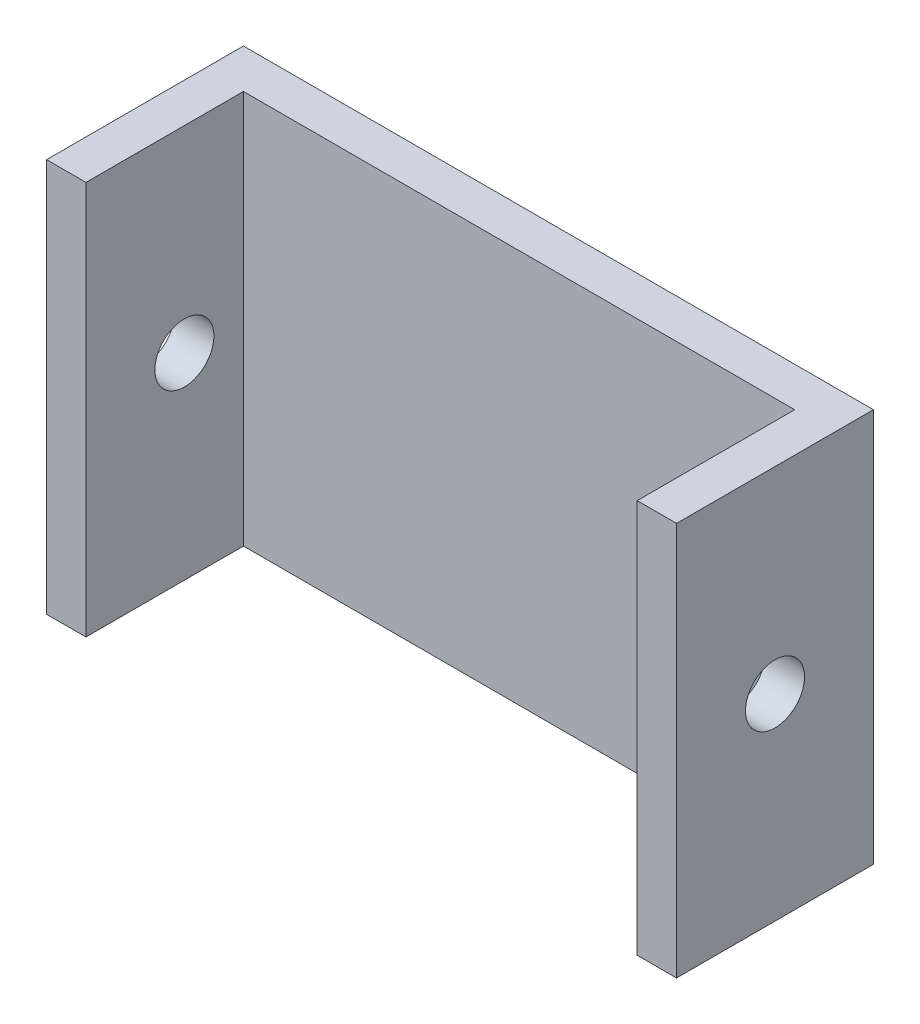
from build123d import *

# Parameters (mm, degrees)
ESQUISSE1_W                  = 28
ESQUISSE1_H                  = 20
BOSS_EXTRU_1_DEPTH           = 2
ESQUISSE2_W                  = 2
ESQUISSE2_H                  = 20
BOSS_EXTRU_2_DEPTH           = 10
ENL_V_MAT_EXTRU_1_DEPTH      = 22.354156504
ENL_V_MAT_EXTRU_1_DEPTH_BACK = 22.354156504
ESQUISSE3_R                  = 1.5
ESQUISSE4_W                  = 1.099038462
ESQUISSE4_H                  = 0.529166666
ENL_V_MAT_EXTRU_2_DEPTH      = 1


with BuildPart() as part:
    # Esquisse1 → Boss.-Extru.1 (new body)
    with BuildSketch(Plane.XY):
        Rectangle(ESQUISSE1_W, ESQUISSE1_H)
    extrude(amount=BOSS_EXTRU_1_DEPTH)

    # Esquisse2 → Boss.-Extru.2 (add)
    with BuildSketch(Plane.XY):
        with Locations((-15, 0)):
            Rectangle(ESQUISSE2_W, ESQUISSE2_H)
        with Locations((15, 0)):
            Rectangle(ESQUISSE2_W, ESQUISSE2_H)
    extrude(amount=BOSS_EXTRU_2_DEPTH)

    # Esquisse3 → Enlèv. mat.-Extru.1 (cut, two sides: drawn at the far end of the back side and taken through both)
    with BuildSketch(Plane(origin=(0, 0, 0), x_dir=(0, 0, -1), z_dir=(1, 0, 0)).offset(-ENL_V_MAT_EXTRU_1_DEPTH_BACK)):
        with Locations((-5, 0)):
            Circle(ESQUISSE3_R)
    extrude(amount=ENL_V_MAT_EXTRU_1_DEPTH + ENL_V_MAT_EXTRU_1_DEPTH_BACK, mode=Mode.SUBTRACT)

    # Esquisse4 → Enlèv. mat.-Extru.2 (cut)
    # profile 1 of 10: a face of its own
    with BuildSketch(Plane(origin=(0, 0, 0), x_dir=(-1, 0, 0), z_dir=(0, 0, -1))):
        Polygon((-14.382426883, 2.175), (-13.790930489, 2.175), (-13.06650641, -0.039613381), (-12.336994191, 2.175), (-11.751221955, 2.175), (-11.214423077, -1), (-11.791291066, -1), (-12.130288462, 1.005363582), (-12.79047476, -1), (-13.346354167, -1), (-14.002724359, 1.005363582), (-14.341085737, -1), (-14.918589744, -1), align=None)
    # profile 2 of 10: a face of its own
    with BuildSketch(Plane(origin=(0, 0, 0), x_dir=(-1, 0, 0), z_dir=(0, 0, -1))):
        with BuildLine():
            Line((-7.958012821, -0.547791466), (-7.419305889, -1.244230769))
            Line((-7.419305889, -1.244230769), (-8.128465545, -1.244230769))
            Line((-8.128465545, -1.244230769), (-8.407677284, -0.883608774))
            add(Edge.make_bspline(
                [(-8.407677284, -0.883608774), (-8.436923867, -0.899533813), (-8.495279076, -0.931308772), (-8.586787742, -0.970931892), (-8.679990398, -1.005692185), (-8.776237577, -1.032930336), (-8.874605223, -1.054370068), (-8.975603022, -1.070739654), (-9.079158703, -1.079370973), (-9.149047866, -1.080727101), (-9.184254808, -1.081410256)],
                knots=[0, 0, 0, 0, 0.985706899, 1.966764212, 2.949968678, 3.929638882, 4.925906056, 5.930211904, 6.957336097, 8, 8, 8, 8], degree=3))
            add(Edge.make_bspline(
                [(-9.184254808, -1.081410256), (-9.242859715, -1.080094869), (-9.357805858, -1.077514902), (-9.526147519, -1.052742163), (-9.687300674, -1.01534206), (-9.840667131, -0.960698595), (-9.986763562, -0.89125893), (-10.124422049, -0.805205067), (-10.255243795, -0.704922884), (-10.37602809, -0.589428191), (-10.486543835, -0.464268204), (-10.583108174, -0.33129517), (-10.665194204, -0.192583753), (-10.732137682, -0.047916361), (-10.784193041, 0.102956411), (-10.820646997, 0.259622481), (-10.843758221, 0.422298361), (-10.846622918, 0.532724268), (-10.848076923, 0.588772035)],
                knots=[0, 0, 0, 0, 1.070144486, 2.098953612, 3.10240755, 4.088674545, 5.067611437, 6.052256776, 7.0494179, 8.074208254, 9.100739571, 10.09639475, 11.072322686, 12.041159829, 13.004031207, 13.983083054, 14.976293755, 16, 16, 16, 16], degree=3))
            add(Edge.make_bspline(
                [(-10.848076923, 0.588772035), (-10.847592214, 0.626327381), (-10.846628933, 0.700962536), (-10.835043388, 0.811570612), (-10.818327857, 0.92000964), (-10.793785207, 1.025696745), (-10.763522437, 1.12940729), (-10.725017212, 1.230316673), (-10.680393258, 1.32938311), (-10.629199705, 1.425783598), (-10.571050731, 1.518092805), (-10.509258594, 1.607044208), (-10.44052463, 1.68978176), (-10.367281634, 1.768168735), (-10.289289031, 1.842153791), (-10.205318552, 1.910211938), (-10.116965871, 1.974032133), (-10.023594389, 2.032276403), (-9.926825064, 2.084923569), (-9.827548543, 2.130677527), (-9.726520447, 2.169819583), (-9.623703082, 2.201705354), (-9.5187837, 2.225600525), (-9.412685506, 2.2437941), (-9.304446436, 2.253914479), (-9.231763487, 2.255572932), (-9.195067107, 2.256410256)],
                knots=[0, 0, 0, 0, 1.035855852, 2.058595393, 3.065553363, 4.06176554, 5.050183643, 6.044349766, 7.039272903, 8.046842428, 9.053256483, 10.04817962, 11.033146707, 12.018200652, 13.007259073, 13.996749908, 14.99846043, 16.012935138, 17.03119782, 18.036301871, 19.027088812, 20.018894167, 21.003704893, 21.994284571, 22.987348552, 24, 24, 24, 24], degree=3))
            add(Edge.make_bspline(
                [(-9.195067107, 2.256410256), (-9.139649678, 2.255001093), (-9.03044954, 2.252224334), (-8.869816845, 2.228480547), (-8.714911908, 2.190657267), (-8.566373477, 2.136010037), (-8.423293684, 2.067107178), (-8.287098509, 1.981850891), (-8.156346756, 1.881999288), (-8.033863117, 1.767504419), (-7.920670205, 1.643249914), (-7.821992695, 1.50993868), (-7.738456246, 1.370116061), (-7.668790529, 1.223726313), (-7.616305103, 1.069913898), (-7.578836807, 0.909700032), (-7.555120466, 0.742971999), (-7.552362935, 0.629345392), (-7.550961538, 0.571599559)],
                knots=[0, 0, 0, 0, 1.015551519, 2.00114601, 2.970254478, 3.93428303, 4.897362978, 5.876714212, 6.874912676, 7.909046156, 8.946527051, 9.952474942, 10.9443724, 11.928494229, 12.919233427, 13.917651329, 14.941735923, 16, 16, 16, 16], degree=3))
            add(Edge.make_bspline(
                [(-7.550961538, 0.571599559), (-7.552126601, 0.518324576), (-7.55441805, 0.413543185), (-7.574269513, 0.259073676), (-7.605603555, 0.11018576), (-7.650606884, -0.033226373), (-7.707638456, -0.171006407), (-7.778699966, -0.302744164), (-7.860642853, -0.43000364), (-7.925394355, -0.508333117), (-7.958012821, -0.547791466)],
                knots=[0, 0, 0, 0, 1.049646143, 2.064447078, 3.064298101, 4.044929938, 5.022708814, 5.998521441, 6.991758374, 8, 8, 8, 8], degree=3))
        make_face()
        with BuildLine():
            add(Edge.make_bspline(
                [(-8.331991186, -0.063146034), (-8.315027893, -0.038825922), (-8.281492128, 0.009253985), (-8.239058558, 0.085515257), (-8.202607642, 0.163262448), (-8.172464162, 0.242903528), (-8.149534051, 0.324894907), (-8.133235845, 0.408701319), (-8.12244288, 0.494361144), (-8.121372654, 0.552062342), (-8.120833333, 0.581139824)],
                knots=[0, 0, 0, 0, 1.031533623, 2.039301536, 3.033003023, 4.018477747, 4.999688364, 5.992485227, 6.988348989, 8, 8, 8, 8], degree=3))
            add(Edge.make_bspline(
                [(-8.120833333, 0.581139824), (-8.121837097, 0.61892283), (-8.123812852, 0.693292914), (-8.138652355, 0.802618034), (-8.163512375, 0.907390986), (-8.198175942, 1.007868214), (-8.241829216, 1.104307641), (-8.296666952, 1.195906242), (-8.361094089, 1.283139766), (-8.434488695, 1.365168117), (-8.514396154, 1.440242217), (-8.599379677, 1.506360438), (-8.688856307, 1.562140444), (-8.782878386, 1.607179158), (-8.880426001, 1.643454645), (-8.982545987, 1.667802938), (-9.088348253, 1.68376733), (-9.160450839, 1.685606706), (-9.19697516, 1.686538462)],
                knots=[0, 0, 0, 0, 1.056263418, 2.079093448, 3.078410197, 4.062632158, 5.04680056, 6.032966551, 7.041959893, 8.074807684, 9.106532056, 10.103754224, 11.080880922, 12.048629763, 13.014470275, 13.984975, 14.979267944, 16, 16, 16, 16], degree=3))
            add(Edge.make_bspline(
                [(-9.19697516, 1.686538462), (-9.234551191, 1.685555352), (-9.308508861, 1.683620382), (-9.4170851, 1.668494694), (-9.521232645, 1.644769489), (-9.620404053, 1.609934883), (-9.714899597, 1.566042518), (-9.804714942, 1.512185734), (-9.889399968, 1.448062961), (-9.969156019, 1.375552409), (-10.0412184, 1.295091877), (-10.104853743, 1.208811209), (-10.158114874, 1.116918458), (-10.202719121, 1.020250439), (-10.2362968, 0.917724644), (-10.260213025, 0.810142959), (-10.275327225, 0.697320349), (-10.277232385, 0.620409309), (-10.278205128, 0.581139824)],
                knots=[0, 0, 0, 0, 1.042613217, 2.052085894, 3.036973397, 4.002832266, 4.963730975, 5.924467509, 6.903642813, 7.907474205, 8.911719447, 9.896835452, 10.877830278, 11.85475743, 12.846581833, 13.865885605, 14.910357018, 16, 16, 16, 16], degree=3))
            add(Edge.make_bspline(
                [(-10.278205128, 0.581139824), (-10.276915703, 0.537620201), (-10.274388642, 0.452328951), (-10.256600021, 0.327911765), (-10.226186676, 0.210399284), (-10.182197655, 0.100425933), (-10.127839055, -0.003556676), (-10.05935651, -0.099333903), (-9.979723898, -0.188799484), (-9.918253289, -0.240876398), (-9.887054287, -0.267307692)],
                knots=[0, 0, 0, 0, 1.078047314, 2.112794111, 3.106520711, 4.077995885, 5.041371964, 6.006121678, 6.988020189, 8, 8, 8, 8], degree=3))
            add(Edge.make_bspline(
                [(-9.887054287, -0.267307692), (-9.861527566, -0.286873566), (-9.810905924, -0.325674345), (-9.729814505, -0.374788307), (-9.646700569, -0.417453824), (-9.560778229, -0.451564441), (-9.472344308, -0.478692482), (-9.381417611, -0.497484182), (-9.287820526, -0.509445903), (-9.224572614, -0.510834712), (-9.192523037, -0.511538462)],
                knots=[0, 0, 0, 0, 1.027457745, 2.037535419, 3.025615023, 4.011018129, 4.9886297, 5.978868484, 6.975833209, 8, 8, 8, 8], degree=3))
            add(Edge.make_bspline(
                [(-9.192523037, -0.511538462), (-9.155751209, -0.510367606), (-9.082765899, -0.508043673), (-8.975338005, -0.487800149), (-8.87066838, -0.457525494), (-8.805048811, -0.426579156), (-8.772115385, -0.411047676)],
                knots=[0, 0, 0, 0, 1.010952568, 2.006554787, 2.999521277, 4, 4, 4, 4], degree=3))
            Line((-8.772115385, -0.411047676), (-9.323542668, 0.302564103))
            Line((-9.323542668, 0.302564103), (-8.614383013, 0.302564103))
            Line((-8.614383013, 0.302564103), (-8.331991186, -0.063146034))
        make_face(mode=Mode.SUBTRACT)
    # profile 3 of 10: a face of its own
    with BuildSketch(Plane(origin=(0, 0, 0), x_dir=(-1, 0, 0), z_dir=(0, 0, -1))):
        with Locations((-6.431570513, 0.160096154)):
            Rectangle(ESQUISSE4_W, ESQUISSE4_H)
    # profile 4 of 10: a face of its own
    with BuildSketch(Plane(origin=(0, 0, 0), x_dir=(-1, 0, 0), z_dir=(0, 0, -1))):
        with BuildLine():
            Line((-4.783012821, 1.116666667), (-5.352884615, 1.116666667))
            add(Edge.make_bspline(
                [(-5.352884615, 1.116666667), (-5.350423427, 1.159774453), (-5.345614411, 1.24400448), (-5.326485364, 1.36635129), (-5.300853097, 1.481955572), (-5.266643434, 1.59041293), (-5.223656753, 1.691683952), (-5.172999214, 1.786113879), (-5.113376631, 1.873205533), (-5.046057969, 1.952538911), (-4.972186113, 2.023709616), (-4.893294716, 2.086814034), (-4.808177027, 2.138886212), (-4.718388216, 2.181736794), (-4.623943573, 2.215972417), (-4.523949502, 2.238861702), (-4.419271807, 2.25436255), (-4.347611448, 2.255718936), (-4.31108774, 2.256410256)],
                knots=[0, 0, 0, 0, 1.199038563, 2.342849363, 3.436047546, 4.486744587, 5.497670872, 6.488682221, 7.459191391, 8.424610317, 9.374430501, 10.305433194, 11.225809216, 12.140057399, 13.06607119, 14.010487599, 14.985989317, 16, 16, 16, 16], degree=3))
            add(Edge.make_bspline(
                [(-4.31108774, 2.256410256), (-4.266255407, 2.255011369), (-4.178732187, 2.252280414), (-4.051554005, 2.22898446), (-3.932783489, 2.190018376), (-3.822506972, 2.135572481), (-3.72166326, 2.066404679), (-3.630269073, 1.983933395), (-3.551088319, 1.886428338), (-3.483618968, 1.777946535), (-3.427560001, 1.663079574), (-3.388276212, 1.544302372), (-3.3624554, 1.424766795), (-3.35970145, 1.344277588), (-3.358333333, 1.304291867)],
                knots=[0, 0, 0, 0, 1.075374347, 2.099382735, 3.09057751, 4.06680945, 5.040638231, 6.016817125, 7.011024321, 8.044445721, 9.0776792, 10.070479129, 11.0414456, 12, 12, 12, 12], degree=3))
            add(Edge.make_bspline(
                [(-3.358333333, 1.304291867), (-3.358866006, 1.280105677), (-3.359938144, 1.23142485), (-3.367392863, 1.157758812), (-3.378576415, 1.082721339), (-3.395438486, 1.006376769), (-3.416466871, 0.928703702), (-3.441977341, 0.849469689), (-3.472561637, 0.769123958), (-3.507709369, 0.68676223), (-3.549640703, 0.602117111), (-3.598463912, 0.513919737), (-3.655474876, 0.422248345), (-3.719984973, 0.32658533), (-3.792307515, 0.227081566), (-3.872795556, 0.124036789), (-3.960522062, 0.017087904), (-4.022784031, -0.054401423), (-4.054772636, -0.091130809)],
                knots=[0, 0, 0, 0, 0.728284026, 1.46585585, 2.227944881, 3.01186502, 3.81876927, 4.650621989, 5.517437689, 6.406905708, 7.346299482, 8.360816762, 9.441613733, 10.596154504, 11.834900912, 13.145207542, 14.533280747, 16, 16, 16, 16], degree=3))
            Line((-4.054772636, -0.091130809), (-4.386137821, -0.470833333))
            Line((-4.386137821, -0.470833333), (-3.317628205, -0.470833333))
            Line((-3.317628205, -0.470833333), (-3.317628205, -1))
            Line((-3.317628205, -1), (-5.434294872, -1))
            Line((-5.434294872, -1), (-5.434294872, -0.711247997))
            Line((-5.434294872, -0.711247997), (-4.494260817, 0.289207732))
            add(Edge.make_bspline(
                [(-4.494260817, 0.289207732), (-4.467044416, 0.318391337), (-4.414334317, 0.374911324), (-4.339333279, 0.457916937), (-4.271463964, 0.536687284), (-4.212133699, 0.612061108), (-4.158228907, 0.681593589), (-4.112153199, 0.747380524), (-4.073485018, 0.808827174), (-4.031505224, 0.882921103), (-3.991638218, 0.971291298), (-3.955057828, 1.073097387), (-3.932759549, 1.17040056), (-3.929681681, 1.2338054), (-3.928205128, 1.264222756)],
                knots=[0, 0, 0, 0, 1.246127091, 2.413378631, 3.493388633, 4.492180848, 5.408488754, 6.240484944, 6.999099869, 7.674939598, 8.898438119, 10.020720584, 11.050475521, 12, 12, 12, 12], degree=3))
            add(Edge.make_bspline(
                [(-3.928205128, 1.264222756), (-3.929309111, 1.293649202), (-3.931448255, 1.350667658), (-3.954955713, 1.431776109), (-3.991374282, 1.505211531), (-4.04269319, 1.568779591), (-4.10485646, 1.621017682), (-4.176691958, 1.659870906), (-4.257614013, 1.682289038), (-4.314341915, 1.685094988), (-4.343524639, 1.686538462)],
                knots=[0, 0, 0, 0, 1.062038974, 2.057870785, 3.028805853, 4.01125022, 4.991535629, 5.949134679, 6.94496649, 8, 8, 8, 8], degree=3))
            add(Edge.make_bspline(
                [(-4.343524639, 1.686538462), (-4.358600807, 1.686005225), (-4.388280663, 1.684955463), (-4.431907732, 1.677967483), (-4.473422022, 1.665651898), (-4.513285612, 1.649150747), (-4.551073065, 1.627278353), (-4.58668907, 1.600317143), (-4.620508887, 1.568952262), (-4.652377404, 1.533281784), (-4.681381915, 1.49347352), (-4.707143616, 1.449891037), (-4.728444253, 1.402561389), (-4.747198109, 1.352109398), (-4.76166198, 1.29799317), (-4.772193472, 1.240536583), (-4.780199862, 1.179833113), (-4.78205811, 1.138105185), (-4.783012821, 1.116666667)],
                knots=[0, 0, 0, 0, 0.903469896, 1.778625579, 2.63899355, 3.493148037, 4.358286772, 5.247621495, 6.164656832, 7.118446693, 8.109501108, 9.111810964, 10.146451449, 11.215617525, 12.33435995, 13.498009769, 14.714554818, 16, 16, 16, 16], degree=3))
        make_face()
    # profile 5 of 10: a face of its own
    with BuildSketch(Plane(origin=(0, 0, 0), x_dir=(-1, 0, 0), z_dir=(0, 0, -1))):
        with BuildLine():
            Line((0.142307692, 1.750776242), (-0.283824119, 1.360897436))
            add(Edge.make_bspline(
                [(-0.283824119, 1.360897436), (-0.302077778, 1.38664612), (-0.337122259, 1.436080004), (-0.393925707, 1.502273139), (-0.450472659, 1.558740809), (-0.507286986, 1.605247119), (-0.564872271, 1.641509507), (-0.623128554, 1.667183679), (-0.681725562, 1.683504993), (-0.721093707, 1.68553739), (-0.740484776, 1.686538462)],
                knots=[0, 0, 0, 0, 1.299362458, 2.494594718, 3.587462134, 4.587049575, 5.512617175, 6.380583204, 7.202344345, 8, 8, 8, 8], degree=3))
            add(Edge.make_bspline(
                [(-0.740484776, 1.686538462), (-0.758572209, 1.685904137), (-0.79349429, 1.684679422), (-0.843278307, 1.672505847), (-0.887477267, 1.651496044), (-0.926048033, 1.62402396), (-0.95660177, 1.590926467), (-0.980996559, 1.556215707), (-0.994732876, 1.517902879), (-0.996540845, 1.491588082), (-0.997435897, 1.478560697)],
                knots=[0, 0, 0, 0, 1.185010067, 2.2879431, 3.333075148, 4.379039566, 5.372662701, 6.27520591, 7.14612461, 8, 8, 8, 8], degree=3))
            add(Edge.make_bspline(
                [(-0.997435897, 1.478560697), (-0.996875014, 1.465345451), (-0.995745472, 1.438731783), (-0.984835633, 1.399726137), (-0.968391391, 1.36161308), (-0.952678246, 1.338411849), (-0.944646434, 1.326552484)],
                knots=[0, 0, 0, 0, 0.967525499, 1.948461899, 2.951351359, 4, 4, 4, 4], degree=3))
            add(Edge.make_bspline(
                [(-0.944646434, 1.326552484), (-0.937344649, 1.317334324), (-0.920536902, 1.296115336), (-0.888487972, 1.262507766), (-0.848241247, 1.221335552), (-0.798247948, 1.174014485), (-0.740583434, 1.118842714), (-0.672574881, 1.057989063), (-0.596179871, 0.989568965), (-0.541880068, 0.941923686), (-0.513426482, 0.916957131)],
                knots=[0, 0, 0, 0, 0.473873513, 1.090794244, 1.870441696, 2.795289791, 3.865433203, 5.087734844, 6.473946851, 8, 8, 8, 8], degree=3))
            add(Edge.make_bspline(
                [(-0.513426482, 0.916957131), (-0.486718699, 0.893842892), (-0.436032876, 0.849976869), (-0.363917015, 0.787716092), (-0.300539184, 0.731701589), (-0.244976112, 0.682774018), (-0.198070082, 0.640420016), (-0.159623901, 0.604437133), (-0.129168012, 0.575525888), (-0.111855623, 0.558063478), (-0.104467147, 0.550610978)],
                knots=[0, 0, 0, 0, 1.543621617, 2.929473131, 4.163658386, 5.240097082, 6.164993805, 6.925417477, 7.541396219, 8, 8, 8, 8], degree=3))
            add(Edge.make_bspline(
                [(-0.104467147, 0.550610978), (-0.07643681, 0.520276149), (-0.022552658, 0.461961956), (0.047477745, 0.371593297), (0.105115031, 0.283375058), (0.149704329, 0.195647272), (0.18337996, 0.1071442), (0.207121726, 0.01569531), (0.221340828, -0.079654982), (0.22291948, -0.144719916), (0.223717949, -0.177629207)],
                knots=[0, 0, 0, 0, 1.206664779, 2.319633467, 3.337109185, 4.282041471, 5.190008762, 6.099243693, 7.03861361, 8, 8, 8, 8], degree=3))
            add(Edge.make_bspline(
                [(0.223717949, -0.177629207), (0.223149619, -0.209695275), (0.222034535, -0.272610094), (0.208376894, -0.36467656), (0.188901899, -0.452788163), (0.15879014, -0.535986126), (0.122090107, -0.615636116), (0.076081314, -0.690497441), (0.022050297, -0.761327728), (-0.039877546, -0.826860799), (-0.108377093, -0.886327518), (-0.181849367, -0.939266196), (-0.261012818, -0.982973818), (-0.345191085, -1.018963927), (-0.434339109, -1.04668399), (-0.528350688, -1.0671717), (-0.62736962, -1.079468101), (-0.695080192, -1.080753544), (-0.729672476, -1.081410256)],
                knots=[0, 0, 0, 0, 1.043214005, 2.046824704, 3.02475056, 3.976699089, 4.921714032, 5.875962561, 6.831408892, 7.817874052, 8.806269674, 9.781291748, 10.760897367, 11.74438705, 12.757449933, 13.795994037, 14.874007457, 16, 16, 16, 16], degree=3))
            add(Edge.make_bspline(
                [(-0.729672476, -1.081410256), (-0.756827124, -1.080928515), (-0.810608901, -1.07997439), (-0.889875108, -1.072184758), (-0.966415592, -1.059613119), (-1.040144137, -1.041594206), (-1.111392902, -1.018761799), (-1.180164813, -0.990872888), (-1.245985116, -0.957495206), (-1.309351837, -0.919315131), (-1.369956937, -0.874983035), (-1.428566743, -0.825405272), (-1.484599087, -0.769819316), (-1.538323081, -0.708356623), (-1.589394983, -0.640843147), (-1.63948656, -0.568219139), (-1.686371593, -0.489136794), (-1.715334563, -0.433659889), (-1.730128205, -0.405323518)],
                knots=[0, 0, 0, 0, 1.016823716, 2.013894106, 2.979844003, 3.91962641, 4.853723003, 5.779685073, 6.695824784, 7.614987388, 8.547259901, 9.504950863, 10.487499108, 11.500346958, 12.559593716, 13.656357062, 14.802919212, 16, 16, 16, 16], degree=3))
            Line((-1.730128205, -0.405323518), (-1.228946314, -0.104487179))
            add(Edge.make_bspline(
                [(-1.228946314, -0.104487179), (-1.210441679, -0.136652663), (-1.174966711, -0.198316645), (-1.114851062, -0.28117002), (-1.053265649, -0.352120221), (-0.988786672, -0.409913198), (-0.922198171, -0.455321719), (-0.853178508, -0.487773798), (-0.781679192, -0.507861598), (-0.732977106, -0.510314782), (-0.708683894, -0.511538462)],
                knots=[0, 0, 0, 0, 1.283663364, 2.460892379, 3.537111102, 4.529833553, 5.449777664, 6.316464042, 7.160231139, 8, 8, 8, 8], degree=3))
            add(Edge.make_bspline(
                [(-0.708683894, -0.511538462), (-0.68397422, -0.510539139), (-0.636033853, -0.508600307), (-0.567605114, -0.490691904), (-0.504867056, -0.462574396), (-0.450636741, -0.422454591), (-0.40471793, -0.376150238), (-0.370827211, -0.324634527), (-0.349536834, -0.268895773), (-0.347285924, -0.230175967), (-0.346153846, -0.210702123)],
                knots=[0, 0, 0, 0, 1.13588714, 2.203786484, 3.234766741, 4.283437687, 5.291419208, 6.222934724, 7.106237994, 8, 8, 8, 8], degree=3))
            add(Edge.make_bspline(
                [(-0.346153846, -0.210702123), (-0.347199274, -0.192584881), (-0.349322961, -0.155781437), (-0.364965384, -0.101060635), (-0.389419262, -0.046364718), (-0.418349925, -0.001501648), (-0.447790496, 0.036060985), (-0.475942323, 0.068607307), (-0.510223801, 0.104565296), (-0.550548007, 0.143980182), (-0.596382154, 0.187198947), (-0.647764851, 0.234217356), (-0.705284483, 0.284621236), (-0.745939473, 0.31895586), (-0.767197516, 0.336909054)],
                knots=[0, 0, 0, 0, 0.916159276, 1.861089862, 2.860218735, 3.940849679, 4.552606315, 5.27541173, 6.11797699, 7.06649574, 8.129236253, 9.306560635, 10.591630461, 12, 12, 12, 12], degree=3))
            add(Edge.make_bspline(
                [(-0.767197516, 0.336909054), (-0.807609902, 0.371101808), (-0.885173501, 0.436728051), (-0.994780708, 0.533655946), (-1.093546616, 0.624243946), (-1.180618176, 0.709611915), (-1.257104814, 0.788183306), (-1.32248853, 0.860596305), (-1.376051054, 0.92740948), (-1.432414061, 1.006545214), (-1.485970187, 1.102977544), (-1.532257877, 1.218996816), (-1.562287377, 1.335001367), (-1.565651765, 1.412880433), (-1.567307692, 1.451211939)],
                knots=[0, 0, 0, 0, 1.345494975, 2.582412109, 3.71882943, 4.751509156, 5.681369928, 6.505683931, 7.230279997, 7.856715994, 8.973648664, 10.023341002, 11.027102913, 12, 12, 12, 12], degree=3))
            add(Edge.make_bspline(
                [(-1.567307692, 1.451211939), (-1.566618994, 1.478394586), (-1.565262186, 1.53194732), (-1.553159242, 1.610688812), (-1.535070932, 1.686667736), (-1.508801513, 1.759606886), (-1.474706979, 1.829414903), (-1.433300492, 1.896433526), (-1.383939087, 1.960045931), (-1.328312117, 2.020209948), (-1.267025437, 2.075193012), (-1.201532831, 2.123721076), (-1.132204994, 2.164708584), (-1.059466037, 2.198710699), (-0.982865227, 2.224737157), (-0.90296688, 2.243186008), (-0.819656395, 2.254158796), (-0.762990401, 2.25565042), (-0.734124599, 2.256410256)],
                knots=[0, 0, 0, 0, 1.010766082, 1.991317756, 2.957454644, 3.913069143, 4.869106762, 5.843196583, 6.838735724, 7.860187025, 8.887984031, 9.89767229, 10.887916223, 11.879572884, 12.879850636, 13.892031539, 14.926195476, 16, 16, 16, 16], degree=3))
            add(Edge.make_bspline(
                [(-0.734124599, 2.256410256), (-0.696715949, 2.255041768), (-0.622193938, 2.252315594), (-0.512010996, 2.230997805), (-0.404388905, 2.197473336), (-0.317665007, 2.157029753), (-0.248660421, 2.117852034), (-0.195774851, 2.081782126), (-0.141960937, 2.040462108), (-0.086784703, 1.993761769), (-0.031271409, 1.940801214), (0.026157453, 1.88284121), (0.084719346, 1.819380848), (0.122775291, 1.774045059), (0.142307692, 1.750776242)],
                knots=[0, 0, 0, 0, 1.282922637, 2.555718331, 3.837320111, 5.142675274, 5.830281639, 6.55870424, 7.337177975, 8.157850921, 9.037902056, 9.96903443, 10.957596896, 12, 12, 12, 12], degree=3))
        make_face()
    # profile 6 of 10: a face of its own
    with BuildSketch(Plane(origin=(0, 0, 0), x_dir=(-1, 0, 0), z_dir=(0, 0, -1))):
        Polygon((0.793589744, 2.175), (2.503205128, 2.175), (2.503205128, 1.605128205), (1.363461538, 1.605128205), (1.363461538, 0.994551282), (2.503205128, 0.994551282), (2.503205128, 0.424679487), (1.363461538, 0.424679487), (1.363461538, -0.430128205), (2.503205128, -0.430128205), (2.503205128, -1), (0.793589744, -1), align=None)
    # profile 7 of 10: a face of its own
    with BuildSketch(Plane(origin=(0, 0, 0), x_dir=(-1, 0, 0), z_dir=(0, 0, -1))):
        Polygon((3.073076923, 2.175), (3.586343149, 2.175), (5.026923077, 0.085682091), (5.026923077, 2.175), (5.596794872, 2.175), (5.596794872, -1), (5.07971254, -1), (3.642948718, 1.082957732), (3.642948718, -1), (3.073076923, -1), align=None)
    # profile 8 of 10: a face of its own
    with BuildSketch(Plane(origin=(0, 0, 0), x_dir=(-1, 0, 0), z_dir=(0, 0, -1))):
        with BuildLine():
            Line((7.957692308, 1.750776242), (7.531560497, 1.360897436))
            add(Edge.make_bspline(
                [(7.531560497, 1.360897436), (7.513306837, 1.38664612), (7.478262356, 1.436080004), (7.421458908, 1.502273139), (7.364911957, 1.558740809), (7.308097629, 1.605247119), (7.250512344, 1.641509507), (7.192256062, 1.667183679), (7.133659053, 1.683504993), (7.094290909, 1.68553739), (7.07489984, 1.686538462)],
                knots=[0, 0, 0, 0, 1.299362458, 2.494594718, 3.587462134, 4.587049575, 5.512617175, 6.380583204, 7.202344345, 8, 8, 8, 8], degree=3))
            add(Edge.make_bspline(
                [(7.07489984, 1.686538462), (7.056812407, 1.685904137), (7.021890326, 1.684679422), (6.972106308, 1.672505847), (6.927907348, 1.651496044), (6.889336583, 1.62402396), (6.858782846, 1.590926467), (6.834388056, 1.556215707), (6.82065174, 1.517902879), (6.81884377, 1.491588082), (6.817948718, 1.478560697)],
                knots=[0, 0, 0, 0, 1.185010067, 2.2879431, 3.333075148, 4.379039566, 5.372662701, 6.27520591, 7.14612461, 8, 8, 8, 8], degree=3))
            add(Edge.make_bspline(
                [(6.817948718, 1.478560697), (6.818509602, 1.465345451), (6.819639144, 1.438731783), (6.830548983, 1.399726137), (6.846993225, 1.36161308), (6.862706369, 1.338411849), (6.870738181, 1.326552484)],
                knots=[0, 0, 0, 0, 0.967525499, 1.948461899, 2.951351359, 4, 4, 4, 4], degree=3))
            add(Edge.make_bspline(
                [(6.870738181, 1.326552484), (6.878039967, 1.317334324), (6.894847713, 1.296115336), (6.926896643, 1.262507766), (6.967143369, 1.221335552), (7.017136668, 1.174014485), (7.074801182, 1.118842714), (7.142809735, 1.057989063), (7.219204745, 0.989568965), (7.273504548, 0.941923686), (7.301958133, 0.916957131)],
                knots=[0, 0, 0, 0, 0.473873513, 1.090794244, 1.870441696, 2.795289791, 3.865433203, 5.087734844, 6.473946851, 8, 8, 8, 8], degree=3))
            add(Edge.make_bspline(
                [(7.301958133, 0.916957131), (7.328665916, 0.893842892), (7.379351739, 0.849976869), (7.4514676, 0.787716092), (7.514845432, 0.731701589), (7.570408503, 0.682774018), (7.617314533, 0.640420016), (7.655760715, 0.604437133), (7.686216603, 0.575525888), (7.703528992, 0.558063478), (7.710917468, 0.550610978)],
                knots=[0, 0, 0, 0, 1.543621617, 2.929473131, 4.163658386, 5.240097082, 6.164993805, 6.925417477, 7.541396219, 8, 8, 8, 8], degree=3))
            add(Edge.make_bspline(
                [(7.710917468, 0.550610978), (7.738947805, 0.520276149), (7.792831957, 0.461961956), (7.86286236, 0.371593297), (7.920499646, 0.283375058), (7.965088944, 0.195647272), (7.998764575, 0.1071442), (8.022506341, 0.01569531), (8.036725443, -0.079654982), (8.038304095, -0.144719916), (8.039102564, -0.177629207)],
                knots=[0, 0, 0, 0, 1.206664779, 2.319633467, 3.337109185, 4.282041471, 5.190008762, 6.099243693, 7.03861361, 8, 8, 8, 8], degree=3))
            add(Edge.make_bspline(
                [(8.039102564, -0.177629207), (8.038534234, -0.209695275), (8.03741915, -0.272610094), (8.023761509, -0.36467656), (8.004286514, -0.452788163), (7.974174755, -0.535986126), (7.937474722, -0.615636116), (7.89146593, -0.690497441), (7.837434912, -0.761327728), (7.77550707, -0.826860799), (7.707007522, -0.886327518), (7.633535248, -0.939266196), (7.554371797, -0.982973818), (7.470193531, -1.018963927), (7.381045506, -1.04668399), (7.287033927, -1.0671717), (7.188014995, -1.079468101), (7.120304423, -1.080753544), (7.085712139, -1.081410256)],
                knots=[0, 0, 0, 0, 1.043214005, 2.046824704, 3.02475056, 3.976699089, 4.921714032, 5.875962561, 6.831408892, 7.817874052, 8.806269674, 9.781291748, 10.760897367, 11.74438705, 12.757449933, 13.795994037, 14.874007457, 16, 16, 16, 16], degree=3))
            add(Edge.make_bspline(
                [(7.085712139, -1.081410256), (7.058557491, -1.080928515), (7.004775715, -1.07997439), (6.925509507, -1.072184758), (6.848969023, -1.059613119), (6.775240479, -1.041594206), (6.703991714, -1.018761799), (6.635219802, -0.990872888), (6.569399499, -0.957495206), (6.506032778, -0.919315131), (6.445427678, -0.874983035), (6.386817872, -0.825405272), (6.330785528, -0.769819316), (6.277061535, -0.708356623), (6.225989632, -0.640843147), (6.175898055, -0.568219139), (6.129013023, -0.489136794), (6.100050052, -0.433659889), (6.08525641, -0.405323518)],
                knots=[0, 0, 0, 0, 1.016823716, 2.013894106, 2.979844003, 3.91962641, 4.853723003, 5.779685073, 6.695824784, 7.614987388, 8.547259901, 9.504950863, 10.487499108, 11.500346958, 12.559593716, 13.656357062, 14.802919212, 16, 16, 16, 16], degree=3))
            Line((6.08525641, -0.405323518), (6.586438301, -0.104487179))
            add(Edge.make_bspline(
                [(6.586438301, -0.104487179), (6.604942937, -0.136652663), (6.640417904, -0.198316645), (6.700533553, -0.28117002), (6.762118966, -0.352120221), (6.826597944, -0.409913198), (6.893186445, -0.455321719), (6.962206107, -0.487773798), (7.033705423, -0.507861598), (7.08240751, -0.510314782), (7.106700721, -0.511538462)],
                knots=[0, 0, 0, 0, 1.283663364, 2.460892379, 3.537111102, 4.529833553, 5.449777664, 6.316464042, 7.160231139, 8, 8, 8, 8], degree=3))
            add(Edge.make_bspline(
                [(7.106700721, -0.511538462), (7.131410395, -0.510539139), (7.179350762, -0.508600307), (7.247779501, -0.490691904), (7.31051756, -0.462574396), (7.364747874, -0.422454591), (7.410666685, -0.376150238), (7.444557404, -0.324634527), (7.465847782, -0.268895773), (7.468098691, -0.230175967), (7.469230769, -0.210702123)],
                knots=[0, 0, 0, 0, 1.13588714, 2.203786484, 3.234766741, 4.283437687, 5.291419208, 6.222934724, 7.106237994, 8, 8, 8, 8], degree=3))
            add(Edge.make_bspline(
                [(7.469230769, -0.210702123), (7.468185341, -0.192584881), (7.466061654, -0.155781437), (7.450419231, -0.101060635), (7.425965353, -0.046364718), (7.397034691, -0.001501648), (7.367594119, 0.036060985), (7.339442293, 0.068607307), (7.305160815, 0.104565296), (7.264836608, 0.143980182), (7.219002461, 0.187198947), (7.167619765, 0.234217356), (7.110100132, 0.284621236), (7.069445142, 0.31895586), (7.048187099, 0.336909054)],
                knots=[0, 0, 0, 0, 0.916159276, 1.861089862, 2.860218735, 3.940849679, 4.552606315, 5.27541173, 6.11797699, 7.06649574, 8.129236253, 9.306560635, 10.591630461, 12, 12, 12, 12], degree=3))
            add(Edge.make_bspline(
                [(7.048187099, 0.336909054), (7.007774714, 0.371101808), (6.930211114, 0.436728051), (6.820603907, 0.533655946), (6.721837999, 0.624243946), (6.63476644, 0.709611915), (6.558279801, 0.788183306), (6.492896085, 0.860596305), (6.439333561, 0.92740948), (6.382970554, 1.006545214), (6.329414428, 1.102977544), (6.283126738, 1.218996816), (6.253097238, 1.335001367), (6.24973285, 1.412880433), (6.248076923, 1.451211939)],
                knots=[0, 0, 0, 0, 1.345494975, 2.582412109, 3.71882943, 4.751509156, 5.681369928, 6.505683931, 7.230279997, 7.856715994, 8.973648664, 10.023341002, 11.027102913, 12, 12, 12, 12], degree=3))
            add(Edge.make_bspline(
                [(6.248076923, 1.451211939), (6.248765621, 1.478394586), (6.25012243, 1.53194732), (6.262225373, 1.610688812), (6.280313683, 1.686667736), (6.306583102, 1.759606886), (6.340677636, 1.829414903), (6.382084123, 1.896433526), (6.431445528, 1.960045931), (6.487072499, 2.020209948), (6.548359178, 2.075193012), (6.613851784, 2.123721076), (6.683179622, 2.164708584), (6.755918579, 2.198710699), (6.832519388, 2.224737157), (6.912417736, 2.243186008), (6.995728221, 2.254158796), (7.052394214, 2.25565042), (7.081260016, 2.256410256)],
                knots=[0, 0, 0, 0, 1.010766082, 1.991317756, 2.957454644, 3.913069143, 4.869106762, 5.843196583, 6.838735724, 7.860187025, 8.887984031, 9.89767229, 10.887916223, 11.879572884, 12.879850636, 13.892031539, 14.926195476, 16, 16, 16, 16], degree=3))
            add(Edge.make_bspline(
                [(7.081260016, 2.256410256), (7.118668667, 2.255041768), (7.193190677, 2.252315594), (7.303373619, 2.230997805), (7.41099571, 2.197473336), (7.497719608, 2.157029753), (7.566724195, 2.117852034), (7.619609764, 2.081782126), (7.673423678, 2.040462108), (7.728599912, 1.993761769), (7.784113206, 1.940801214), (7.841542069, 1.88284121), (7.900103961, 1.819380848), (7.938159906, 1.774045059), (7.957692308, 1.750776242)],
                knots=[0, 0, 0, 0, 1.282922637, 2.555718331, 3.837320111, 5.142675274, 5.830281639, 6.55870424, 7.337177975, 8.157850921, 9.037902056, 9.96903443, 10.957596896, 12, 12, 12, 12], degree=3))
        make_face()
    # profile 9 of 10: a face of its own
    with BuildSketch(Plane(origin=(0, 0, 0), x_dir=(-1, 0, 0), z_dir=(0, 0, -1))):
        with BuildLine():
            add(Edge.make_bspline(
                [(10.101071715, 2.256410256), (10.156272981, 2.254980997), (10.265252783, 2.252159315), (10.425522746, 2.228638391), (10.579972488, 2.190314418), (10.728532169, 2.137041323), (10.870829812, 2.067376201), (11.007367349, 1.983294103), (11.137655708, 1.883208031), (11.260359799, 1.769452826), (11.373760509, 1.645749008), (11.472022291, 1.512559855), (11.555816334, 1.373336432), (11.62526506, 1.227705686), (11.678163192, 1.074659054), (11.715283999, 0.914976872), (11.739132279, 0.748704567), (11.741875198, 0.635495791), (11.743269231, 0.577959736)],
                knots=[0, 0, 0, 0, 1.014329547, 2.002516266, 2.970391464, 3.935626869, 4.897733899, 5.877609409, 6.878433252, 7.912639331, 8.949961323, 9.958554974, 10.949718813, 11.932905612, 12.9188844, 13.919928257, 14.942845884, 16, 16, 16, 16], degree=3))
            add(Edge.make_bspline(
                [(11.743269231, 0.577959736), (11.741784646, 0.521071978), (11.738859225, 0.408972828), (11.716257591, 0.244232788), (11.678511664, 0.086261135), (11.626510726, -0.065299705), (11.558321537, -0.209715622), (11.476161569, -0.347908692), (11.377862778, -0.478596451), (11.267010507, -0.601708765), (11.144971776, -0.713459608), (11.015713386, -0.811939845), (10.879832174, -0.895388282), (10.737527025, -0.963766694), (10.588492773, -1.016832662), (10.433097551, -1.054274558), (10.271350974, -1.077028754), (10.161355459, -1.079935067), (10.105523838, -1.081410256)],
                knots=[0, 0, 0, 0, 1.051557043, 2.072126891, 3.067553643, 4.050577992, 5.02905126, 6.015227836, 7.017913613, 8.04756643, 9.074058332, 10.072836633, 11.047628519, 12.017157415, 12.98668631, 13.966869689, 14.968021931, 16, 16, 16, 16], degree=3))
            add(Edge.make_bspline(
                [(10.105523838, -1.081410256), (10.047130658, -1.080086939), (9.932396039, -1.077486802), (9.764481412, -1.052760683), (9.60360469, -1.01551451), (9.45111733, -0.959926594), (9.30546638, -0.890437026), (9.167721978, -0.804856457), (9.037930418, -0.703326315), (8.916836203, -0.588446825), (8.807124551, -0.462743465), (8.710282498, -0.329949014), (8.628594078, -0.191077902), (8.562056303, -0.046065137), (8.509600593, 0.104188064), (8.47259905, 0.260596786), (8.450741356, 0.422785903), (8.447696706, 0.532947994), (8.446153846, 0.588772035)],
                knots=[0, 0, 0, 0, 1.067978421, 2.098431617, 3.099715153, 4.085208694, 5.062210972, 6.048429807, 7.046490867, 8.072918869, 9.098532598, 10.095778865, 11.076610158, 12.041847152, 13.011192615, 13.984257998, 14.978533688, 16, 16, 16, 16], degree=3))
            add(Edge.make_bspline(
                [(8.446153846, 0.588772035), (8.446638084, 0.626327528), (8.447600429, 0.700962974), (8.459192889, 0.811568896), (8.475882697, 0.920015938), (8.500566132, 1.025871722), (8.530550197, 1.12988301), (8.569398788, 1.231081639), (8.613618999, 1.330548689), (8.665286151, 1.427109331), (8.722735028, 1.519875124), (8.785416868, 1.608408477), (8.853489284, 1.691638892), (8.926732991, 1.770113325), (9.005400397, 1.843315958), (9.088456714, 1.912283076), (9.177512751, 1.975182667), (9.27061935, 2.033550865), (9.367251598, 2.086332215), (9.467016114, 2.13125812), (9.567857552, 2.170491149), (9.671123017, 2.201455589), (9.775705837, 2.226675803), (9.882723267, 2.243354362), (9.991208465, 2.2549465), (10.064363722, 2.25592118), (10.101071715, 2.256410256)],
                knots=[0, 0, 0, 0, 1.034744296, 2.056386356, 3.06226378, 4.057406941, 5.050368692, 6.043467995, 7.042652155, 8.049140477, 9.059438543, 10.048523776, 11.036952808, 12.020949711, 13.004946614, 13.997082645, 14.994316842, 16.007702937, 17.024872941, 18.026463647, 19.021641123, 20.005082605, 20.995858141, 21.984425357, 22.988620895, 24, 24, 24, 24], degree=3))
        make_face()
        with BuildLine():
            add(Edge.make_bspline(
                [(10.092167468, 1.686538462), (10.055017023, 1.685541632), (9.981696911, 1.683574288), (9.87414966, 1.668585794), (9.770900501, 1.644647465), (9.672521784, 1.609973087), (9.578587129, 1.565841405), (9.488930018, 1.51240662), (9.404792016, 1.44783197), (9.325051225, 1.375584181), (9.253018542, 1.295083541), (9.189375394, 1.208813414), (9.13611633, 1.116917871), (9.09151153, 1.020250599), (9.057934002, 0.9177246), (9.034017735, 0.810142972), (9.018903547, 0.697320346), (9.016998385, 0.620409308), (9.016025641, 0.581139824)],
                knots=[0, 0, 0, 0, 1.033739768, 2.040188636, 3.016340934, 3.979330865, 4.937572243, 5.900995986, 6.878200029, 7.884839167, 8.891893314, 9.879764717, 10.863503415, 11.843163062, 12.837761627, 13.859916423, 14.907309254, 16, 16, 16, 16], degree=3))
            add(Edge.make_bspline(
                [(9.016025641, 0.581139824), (9.017315351, 0.537620401), (9.019842968, 0.452329544), (9.037627592, 0.32790954), (9.068055314, 0.210407195), (9.111992352, 0.100397195), (9.166485806, -0.003342038), (9.234158028, -0.099539033), (9.313913047, -0.188769773), (9.375355667, -0.240866395), (9.406540465, -0.267307692)],
                knots=[0, 0, 0, 0, 1.078454662, 2.113592447, 3.107694534, 4.079536787, 5.043276885, 6.005368276, 6.987637804, 8, 8, 8, 8], degree=3))
            add(Edge.make_bspline(
                [(9.406540465, -0.267307692), (9.432086767, -0.286841507), (9.48260381, -0.325469037), (9.563240009, -0.374978141), (9.646279416, -0.417412382), (9.732348667, -0.451698747), (9.821265988, -0.478667825), (9.913019187, -0.497553827), (10.007478257, -0.509406426), (10.071355906, -0.510823036), (10.103615785, -0.511538462)],
                knots=[0, 0, 0, 0, 1.023928204, 2.024787132, 3.009472467, 3.9914905, 4.972207045, 5.96565515, 6.972602802, 8, 8, 8, 8], degree=3))
            add(Edge.make_bspline(
                [(10.103615785, -0.511538462), (10.140127427, -0.51053318), (10.211965231, -0.508555256), (10.317510432, -0.493751278), (10.418625941, -0.468697603), (10.51593949, -0.434327401), (10.609170471, -0.389641607), (10.697863239, -0.334549442), (10.782173297, -0.269727367), (10.861812499, -0.196530807), (10.934606495, -0.11571305), (10.998116833, -0.028982767), (11.053069269, 0.061749113), (11.096746511, 0.157766763), (11.131650612, 0.258163822), (11.155279034, 0.363384925), (11.170520902, 0.472996313), (11.172426601, 0.547590736), (11.173397436, 0.585591947)],
                knots=[0, 0, 0, 0, 1.026359118, 2.019393844, 2.989460624, 3.950973911, 4.916101784, 5.890408035, 6.881132271, 7.902007068, 8.92769091, 9.933912415, 10.920395702, 11.90457117, 12.894218921, 13.903490204, 14.931958862, 16, 16, 16, 16], degree=3))
            add(Edge.make_bspline(
                [(11.173397436, 0.585591947), (11.17239301, 0.623374641), (11.170415951, 0.697744112), (11.155585917, 0.807073689), (11.130691125, 0.911830273), (11.096217714, 1.012184941), (11.052196992, 1.108236078), (10.997760905, 1.199645912), (10.93310046, 1.286326071), (10.859703815, 1.367685865), (10.779816078, 1.442450303), (10.694048609, 1.507332245), (10.60480128, 1.56371259), (10.510026321, 1.607878675), (10.411662748, 1.643065702), (10.309110341, 1.668977933), (10.201980677, 1.683468994), (10.129098152, 1.685506185), (10.092167468, 1.686538462)],
                knots=[0, 0, 0, 0, 1.055025985, 2.07665775, 3.074803781, 4.057872707, 5.035505728, 6.020516407, 7.023567878, 8.050795229, 9.077271434, 10.074415901, 11.050397877, 12.019801805, 12.988065821, 13.964604439, 14.968634123, 16, 16, 16, 16], degree=3))
        make_face(mode=Mode.SUBTRACT)
    # profile 10 of 10: a face of its own
    with BuildSketch(Plane(origin=(0, 0, 0), x_dir=(-1, 0, 0), z_dir=(0, 0, -1))):
        with BuildLine():
            Line((12.313141026, 2.175), (12.977143429, 2.175))
            add(Edge.make_bspline(
                [(12.977143429, 2.175), (13.021033786, 2.174844214), (13.105447306, 2.174544595), (13.22716699, 2.169817392), (13.338983259, 2.163239101), (13.441061667, 2.153200455), (13.533358544, 2.139890424), (13.615966391, 2.124200099), (13.688882796, 2.10631761), (13.752722706, 2.084034619), (13.810335068, 2.058899742), (13.864037799, 2.030019307), (13.915015662, 1.997714908), (13.962927923, 1.961136528), (14.008190953, 1.920942202), (14.050890141, 1.877091473), (14.090422111, 1.829212502), (14.126542077, 1.777607826), (14.159462518, 1.72332089), (14.188557284, 1.666277157), (14.212217196, 1.606436959), (14.233123264, 1.544665114), (14.248181228, 1.480078583), (14.258653821, 1.413306125), (14.266321445, 1.344112696), (14.266762296, 1.297105753), (14.266987179, 1.273127003)],
                knots=[0, 0, 0, 0, 1.749336639, 3.364467119, 4.854658419, 6.213483162, 7.451590619, 8.570285859, 9.5643256, 10.440900261, 11.26203566, 12.067320669, 12.869050712, 13.665104639, 14.467235401, 15.27997916, 16.102287765, 16.939272006, 17.78853747, 18.631303466, 19.488103222, 20.351255419, 21.228522269, 22.127379805, 23.044756219, 24, 24, 24, 24], degree=3))
            add(Edge.make_bspline(
                [(14.266987179, 1.273127003), (14.266403014, 1.248098697), (14.265257571, 1.199022751), (14.259087595, 1.126934188), (14.247810817, 1.057964894), (14.230730496, 0.992316801), (14.211098885, 0.929172843), (14.184993878, 0.869698066), (14.155531799, 0.813027495), (14.120540547, 0.759962756), (14.082139358, 0.709325176), (14.037479583, 0.663054868), (13.989454489, 0.618664978), (13.935364411, 0.578935939), (13.87759369, 0.541181417), (13.814994483, 0.506965765), (13.747975333, 0.475428881), (13.700857551, 0.457841737), (13.676762821, 0.448848157)],
                knots=[0, 0, 0, 0, 1.099860209, 2.156625411, 3.176576793, 4.16617041, 5.135385252, 6.078461593, 7.016046972, 7.938469504, 8.868247731, 9.803980173, 10.76021508, 11.73834243, 12.748633912, 13.790971185, 14.870363756, 16, 16, 16, 16], degree=3))
            Line((13.676762821, 0.448848157), (14.409455128, -1))
            Line((14.409455128, -1), (13.775981571, -1))
            Line((13.775981571, -1), (13.076362179, 0.383974359))
            Line((13.076362179, 0.383974359), (12.883012821, 0.383974359))
            Line((12.883012821, 0.383974359), (12.883012821, -1))
            Line((12.883012821, -1), (12.313141026, -1))
            Line((12.313141026, -1), (12.313141026, 2.175))
        make_face()
        with BuildLine():
            Line((12.883012821, 0.953846154), (13.104982973, 0.953846154))
            add(Edge.make_bspline(
                [(13.104982973, 0.953846154), (13.132120669, 0.954151797), (13.184083526, 0.954737037), (13.25881294, 0.957451626), (13.326685069, 0.963992443), (13.38799138, 0.972256521), (13.443040361, 0.981798593), (13.491340994, 0.99547296), (13.533637518, 1.010125392), (13.569428718, 1.028334563), (13.600007897, 1.04904234), (13.62641106, 1.072566889), (13.648250262, 1.09979356), (13.666225039, 1.129982448), (13.680207462, 1.163400567), (13.690413559, 1.199681062), (13.696117258, 1.239237214), (13.696773488, 1.266536345), (13.697115385, 1.280759215)],
                knots=[0, 0, 0, 0, 1.688639943, 3.233382647, 4.650958383, 5.928841754, 7.082724185, 8.122798841, 9.049171256, 9.863274652, 10.613301712, 11.341792392, 12.054588806, 12.776240173, 13.521029143, 14.301969904, 15.115324896, 16, 16, 16, 16], degree=3))
            add(Edge.make_bspline(
                [(13.697115385, 1.280759215), (13.696468998, 1.297585908), (13.695199292, 1.33063883), (13.68259986, 1.378223447), (13.662544286, 1.422266266), (13.635053587, 1.46256829), (13.600432626, 1.497899827), (13.560702342, 1.529044858), (13.515005259, 1.553672018), (13.472693199, 1.56991583), (13.434199114, 1.579634671), (13.399459417, 1.586877065), (13.359230639, 1.592009958), (13.313482409, 1.597454304), (13.262331341, 1.600984687), (13.205498631, 1.603561163), (13.143147503, 1.604615326), (13.099682844, 1.604952323), (13.076998197, 1.605128205)],
                knots=[0, 0, 0, 0, 1.020303359, 2.004196876, 2.966617323, 3.9489082, 4.950758222, 5.960522915, 7.003732012, 8.091992268, 8.70421221, 9.413913587, 10.24622431, 11.166358409, 12.212345909, 13.359657661, 14.621978493, 16, 16, 16, 16], degree=3))
            Line((13.076998197, 1.605128205), (12.883012821, 1.605128205))
            Line((12.883012821, 1.605128205), (12.883012821, 0.953846154))
        make_face(mode=Mode.SUBTRACT)
    extrude(amount=-ENL_V_MAT_EXTRU_2_DEPTH, mode=Mode.SUBTRACT)


solid = part.part
